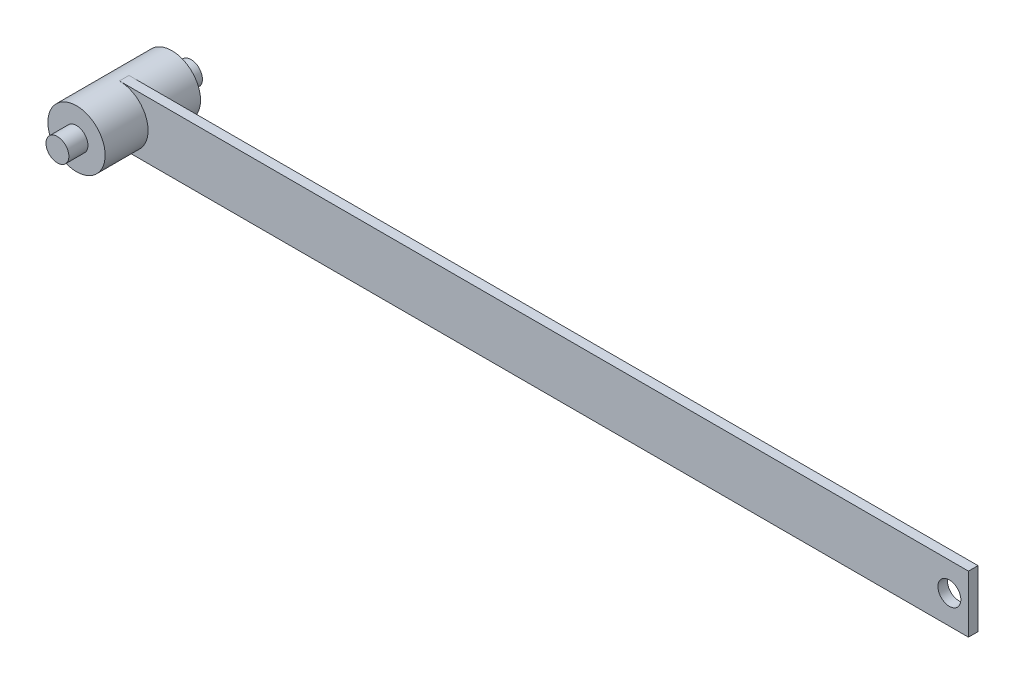
from build123d import *

# Parameters (mm, degrees)
SKETCH_1_W      = 460
SKETCH_1_H      = 30
SKETCH_1_R      = 6
EXTRUDE_1_DEPTH = 2.5
FILLET_1_RADIUS = 15
FILLET_1_LENGTH = 5
SKETCH_3_R      = 15
EXTRUDE_2_DEPTH = 25
SKETCH_4_R      = 6
EXTRUDE_3_DEPTH = 35


with BuildPart() as part:
    # 草图1 → 凸台-拉伸1 (new, symmetric)
    with BuildSketch(Plane.XY):
        Rectangle(SKETCH_1_W, SKETCH_1_H)
        with Locations((-220, 0)):
            Circle(SKETCH_1_R, mode=Mode.SUBTRACT)
        with Locations((220, 0)):
            Circle(SKETCH_1_R, mode=Mode.SUBTRACT)
    extrude(amount=EXTRUDE_1_DEPTH, both=True)

    # 圆角1: full round fillet: the end face becomes a half cylinder, R = half its width
    fillet_1_face = Plane((-230, 0, 0), x_dir=(0, 0, 1), z_dir=(-1, 0, 0))  # on the end face: x along it, z out of the body
    fillet_1_slab = fillet_1_face.offset(-FILLET_1_RADIUS / 2) * Box(FILLET_1_LENGTH, 2 * FILLET_1_RADIUS, FILLET_1_RADIUS, mode=Mode.PRIVATE)  # the body's end, R deep
    fillet_1_round = Plane((-215, 0, 0), x_dir=(-1, 0, 0), z_dir=(0, 0, 1)) * Cylinder(FILLET_1_RADIUS, FILLET_1_LENGTH, mode=Mode.PRIVATE)  # its axis R under the face
    add(fillet_1_slab - fillet_1_round, mode=Mode.SUBTRACT)

    # 草图3 → 凸台-拉伸2 (add, symmetric)
    with BuildSketch(Plane.XY):
        with Locations((-215, 0)):
            Circle(SKETCH_3_R)
    extrude(amount=EXTRUDE_2_DEPTH, both=True)

    # 草图4 → 凸台-拉伸3 (add, symmetric)
    with BuildSketch(Plane.XY):
        with Locations((-215, 0)):
            Circle(SKETCH_4_R)
    extrude(amount=EXTRUDE_3_DEPTH, both=True)


solid = part.part
